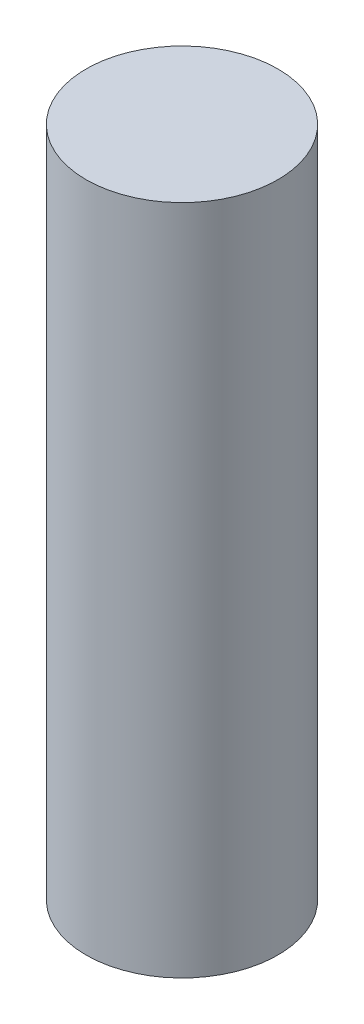
from build123d import *

# Parameters (mm, degrees)
SKETCH_1_R      = 10
EXTRUDE_1_DEPTH = 70


with BuildPart() as part:
    # 草图1 → 凸台-拉伸1 (new body)
    with BuildSketch(Plane(origin=(0, 0, 0), x_dir=(1, 0, 0), z_dir=(0, 1, 0))):
        with Locations(Location((0, 0, 0), (0, 0, 270))):
            Circle(SKETCH_1_R)
    extrude(amount=EXTRUDE_1_DEPTH)


solid = part.part
